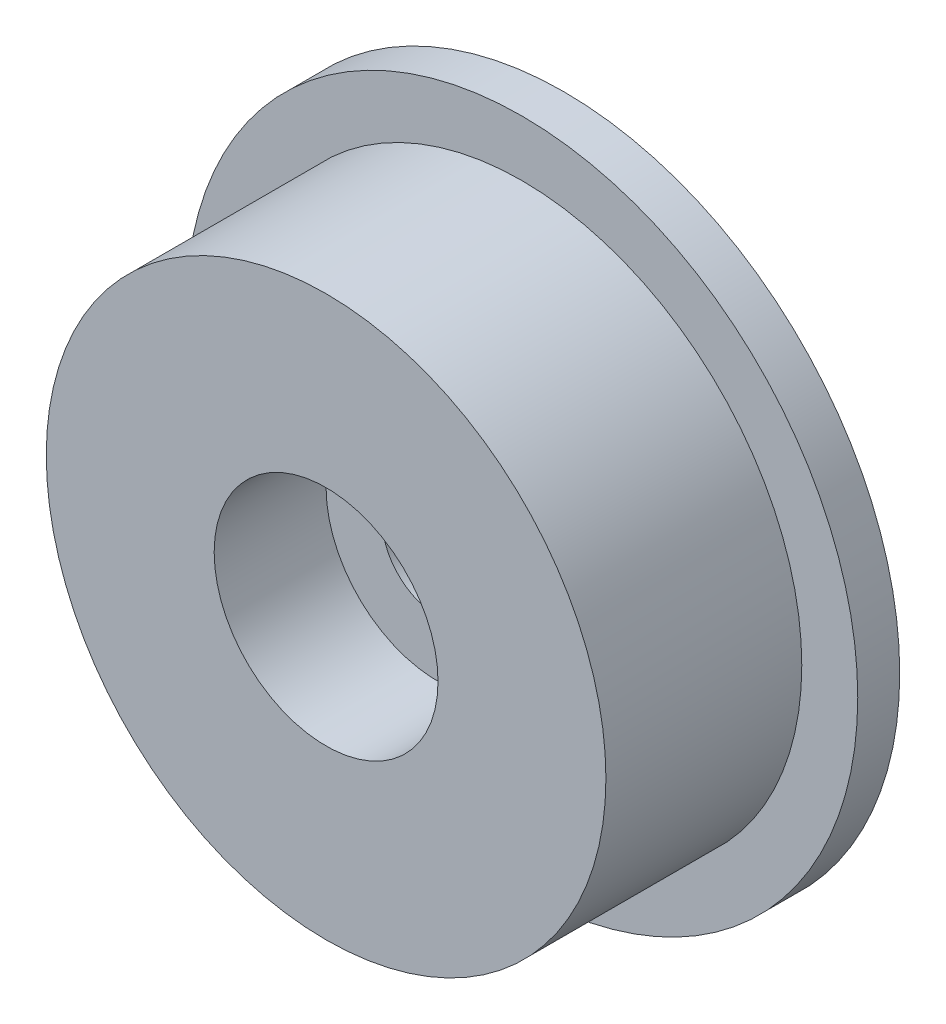
from build123d import *

# Parameters (mm, degrees)
SKETCH_1_R          = 12
EXTRUDE_1_DEPTH     = 1.5
SKETCH_2_R          = 10
EXTRUDE_2_DEPTH     = 7
SKETCH_3_R          = 2
CUT_EXTRUDE_1_DEPTH = 27
SKETCH_4_R          = 4
CUT_EXTRUDE_2_DEPTH = 4


with BuildPart() as part:
    # 草图1 → 凸台-拉伸1 (new body)
    with BuildSketch(Plane.XY):
        Circle(SKETCH_1_R)
    extrude(amount=EXTRUDE_1_DEPTH)

    # 草图2 → 凸台-拉伸2 (add)
    with BuildSketch(Plane.XY.offset(1.5)):
        Circle(SKETCH_2_R)
    extrude(amount=EXTRUDE_2_DEPTH)

    # 草图3 → 切除-拉伸1 (cut)
    with BuildSketch(Plane(origin=(0, 0, 0), x_dir=(-1, 0, 0), z_dir=(0, 0, -1))):
        Circle(SKETCH_3_R)
    extrude(amount=-CUT_EXTRUDE_1_DEPTH, mode=Mode.SUBTRACT)

    # 草图4 → 切除-拉伸2 (cut)
    with BuildSketch(Plane.XY.offset(8.5)):
        Circle(SKETCH_4_R)
    extrude(amount=-CUT_EXTRUDE_2_DEPTH, mode=Mode.SUBTRACT)


solid = part.part
